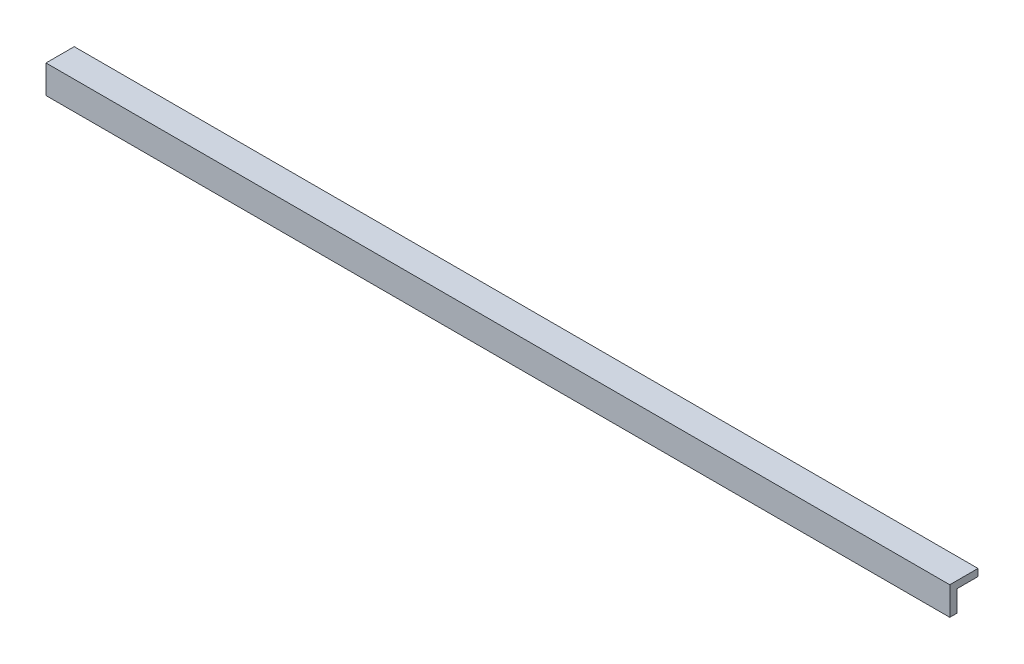
from build123d import *

# Parameters (mm, degrees)
BOSS_EXTRUDE1_DEPTH = 203.2


with BuildPart() as part:
    # Sketch1 → Boss-Extrude1 (new body)
    with BuildSketch(Plane(origin=(0, 0, 0), x_dir=(0, 0, -1), z_dir=(1, 0, 0))):
        Polygon((0, 0), (0, 6.35), (6.35, 6.35), (6.35, 4.7625), (1.5875, 4.7625), (1.5875, 0), align=None)
    extrude(amount=BOSS_EXTRUDE1_DEPTH)


solid = part.part
